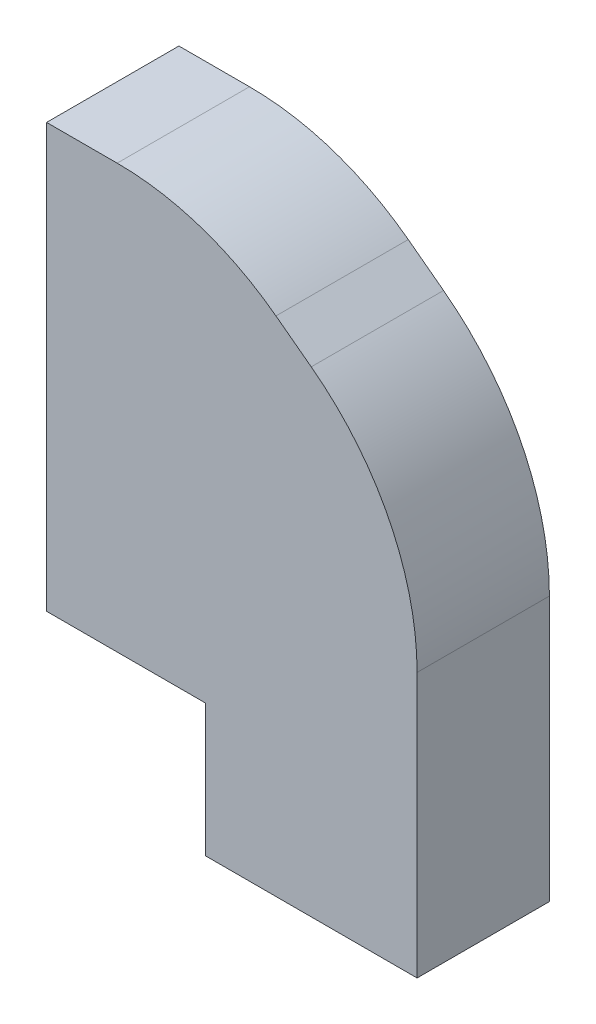
from build123d import *

# Parameters (mm, degrees)
BOSS_EXTRUDE1_DEPTH = 0.125
FILLET1_R           = 0.5


with BuildPart() as part:
    # frame_outline → Boss-Extrude1 (new, symmetric)
    with BuildSketch(Plane.XY):
        Polygon((0, 0), (0.3, 0), (0.3, -0.25), (0.7, -0.25), (0.7, -0.128713314), (0.7, 0.5), (0.3, 0.8), (0, 0.8), align=None)
    extrude(amount=BOSS_EXTRUDE1_DEPTH, both=True)

    # Fillet1
    fillet1_edges = [part.edges().sort_by_distance(p)[0] for p in [
        (0.3, 0.8, 0),
        (0.7, 0.5, 0),
    ]]
    fillet(fillet1_edges, radius=FILLET1_R)


solid = part.part
